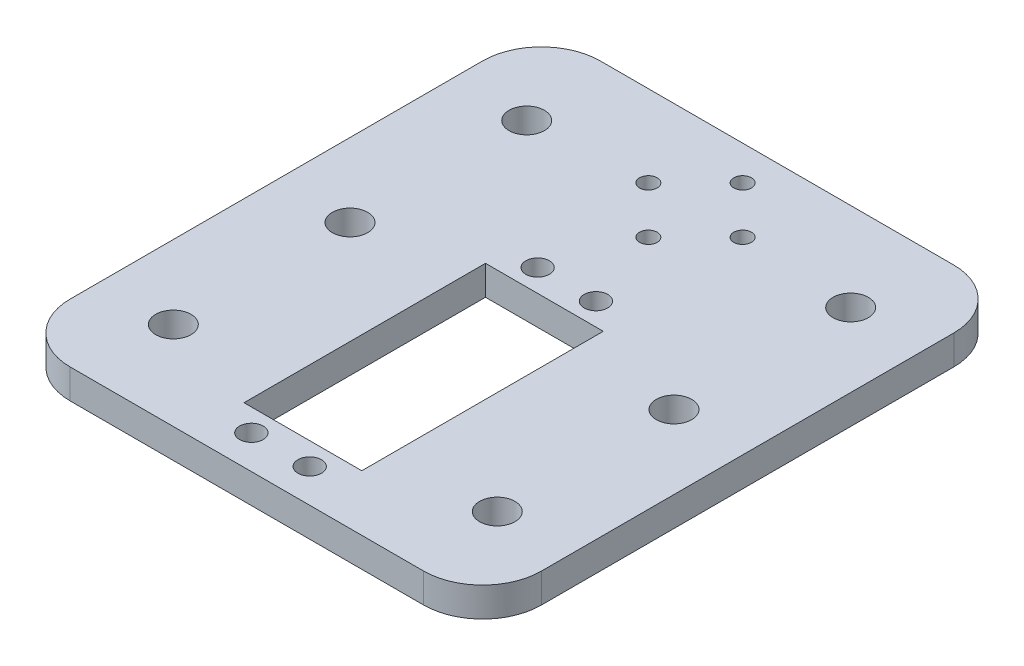
from build123d import *

# Parameters (mm, degrees)
SKETCH_1_W          = 80
SKETCH_1_H          = 90
SKETCH_1_R          = 3
SKETCH_1_R_2        = 2
SKETCH_1_W_2        = 20
SKETCH_1_H_2        = 41
EXTRUDE_1_DEPTH     = 5
FILLET_1_R          = 10
SKETCH_2_R          = 1.5
CUT_EXTRUDE_1_DEPTH = 73.284161474


with BuildPart() as part:
    # 草图1 → 凸台-拉伸1 (new body)
    with BuildSketch(Plane(origin=(0, 0, 0), x_dir=(1, 0, 0), z_dir=(0, 1, 0))):
        with Locations((0, 15)):
            Rectangle(SKETCH_1_W, SKETCH_1_H)
        with Locations(Location((27.5, 15, 0), (0, 0, 270))):
            Circle(SKETCH_1_R, mode=Mode.SUBTRACT)
        with Locations(Location((27.5, -15, 0), (0, 0, 270))):
            Circle(SKETCH_1_R, mode=Mode.SUBTRACT)
        with Locations(Location((-27.5, -15, 0), (0, 0, 90))):
            Circle(SKETCH_1_R, mode=Mode.SUBTRACT)
        with Locations(Location((-27.5, 15, 0), (0, 0, 90))):
            Circle(SKETCH_1_R, mode=Mode.SUBTRACT)
        with Locations(Location((4.95, 24.3, 0), (0, 0, 270))):
            Circle(SKETCH_1_R_2, mode=Mode.SUBTRACT)
        with Locations(Location((-4.95, 24.3, 0), (0, 0, 90))):
            Circle(SKETCH_1_R_2, mode=Mode.SUBTRACT)
        with Locations(Location((4.95, -24.3, 0), (0, 0, 90))):
            Circle(SKETCH_1_R_2, mode=Mode.SUBTRACT)
        with Locations(Location((-4.95, -24.3, 0), (0, 0, 270))):
            Circle(SKETCH_1_R_2, mode=Mode.SUBTRACT)
        with Locations(Location((-27.5, 45, 0), (0, 0, 90))):
            Circle(SKETCH_1_R, mode=Mode.SUBTRACT)
        with Locations(Location((27.5, 45, 0), (0, 0, 270))):
            Circle(SKETCH_1_R, mode=Mode.SUBTRACT)
        Rectangle(SKETCH_1_W_2, SKETCH_1_H_2, mode=Mode.SUBTRACT)
    extrude(amount=EXTRUDE_1_DEPTH)

    # 圆角1
    fillet_1_edges = [part.edges().sort_by_distance(p)[0] for p in [
        (40, 2.5, -60),
        (40, 2.5, 30),
        (-40, 2.5, 30),
        (-40, 2.5, -60),
    ]]
    fillet(fillet_1_edges, radius=FILLET_1_R)

    # 草图2 → 切除-拉伸1 (cut, through all)
    with BuildSketch(Plane(origin=(0, 0, 0), x_dir=(1, 0, 0), z_dir=(0, 1, 0))):
        with Locations(Location((0, 54.15, 0), (0, 0, 270))):
            Circle(SKETCH_2_R)
        with Locations(Location((8, 46.15, 0), (0, 0, 270))):
            Circle(SKETCH_2_R)
        with Locations(Location((0, 38.15, 0), (0, 0, 270))):
            Circle(SKETCH_2_R)
        with Locations(Location((-8, 46.15, 0), (0, 0, 270))):
            Circle(SKETCH_2_R)
    extrude(amount=CUT_EXTRUDE_1_DEPTH, mode=Mode.SUBTRACT)


solid = part.part
